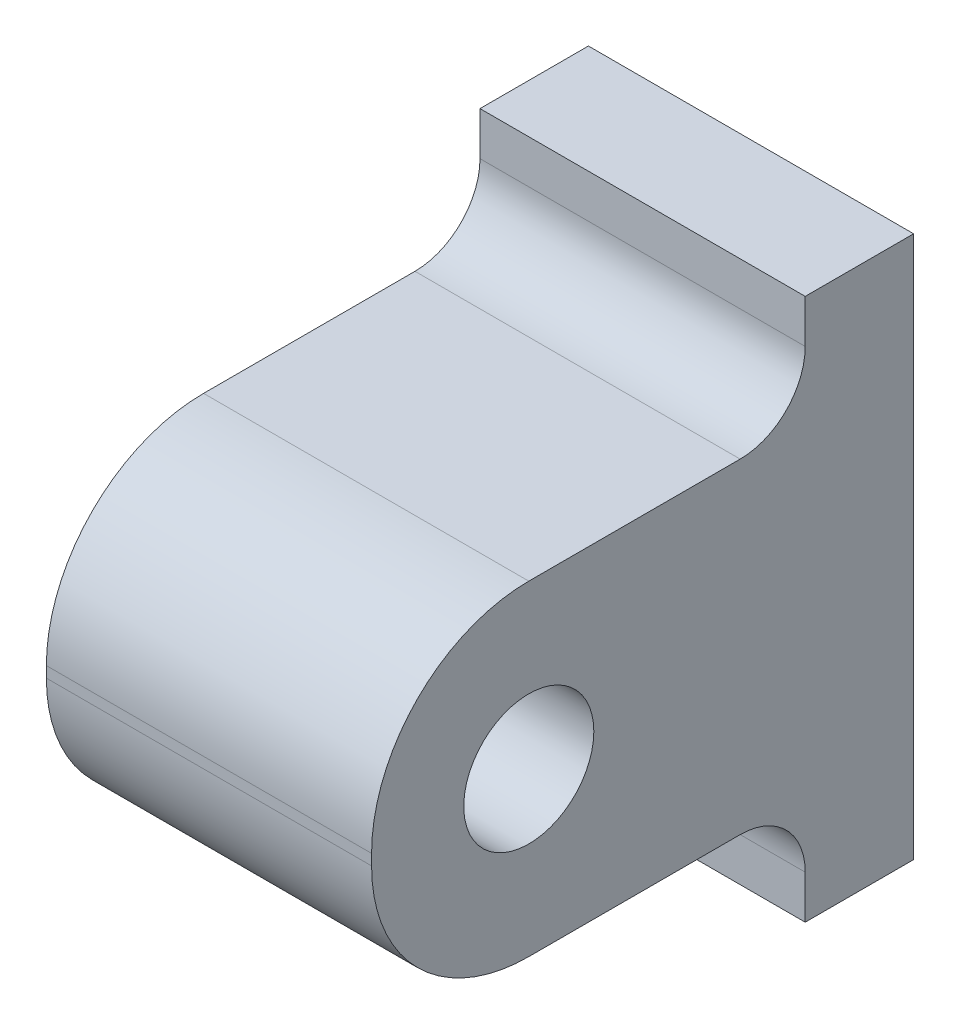
from build123d import *

# Parameters (mm, degrees)
RESSALTO_EXTRUS_O2_DEPTH = 30
ESBO_O5_R                = 6
CORTE_EXTRUS_O1_DEPTH    = 30


with BuildPart() as part:
    # Esboço3 → Ressalto-extrusão2 (new body)
    with BuildSketch(Plane(origin=(0, 0, 0), x_dir=(0, 0, -1), z_dir=(1, 0, 0))):
        with BuildLine():
            Line((42.248831229, -47.335013165), (42.248831229, 2.664986835))
            Line((42.248831229, 2.664986835), (32.248831229, 2.664986835))
            Line((32.248831229, 2.664986835), (32.248831229, -1.335013165))
            ThreePointArc((32.248831229, -1.335013165), (30.491471916, -5.577653852), (26.248831229, -7.335013165))
            Line((26.248831229, -7.335013165), (6.748831229, -7.335013165))
            ThreePointArc((6.748831229, -7.335013165), (-3.504217098, -11.581964838), (-7.751168771, -21.835013165))
            Line((-7.751168771, -21.835013165), (-7.751168771, -22.835013165))
            ThreePointArc((-7.751168771, -22.835013165), (-3.504217098, -33.088061493), (6.748831229, -37.335013165))
            Line((6.748831229, -37.335013165), (26.248831229, -37.335013165))
            ThreePointArc((26.248831229, -37.335013165), (30.491471916, -39.092372478), (32.248831229, -43.335013165))
            Line((32.248831229, -43.335013165), (32.248831229, -47.335013165))
            Line((32.248831229, -47.335013165), (42.248831229, -47.335013165))
        make_face()
    extrude(amount=-RESSALTO_EXTRUS_O2_DEPTH)

    # Esboço5 → Corte-extrusão1 (cut)
    with BuildSketch(Plane(origin=(0, 0, 0), x_dir=(0, 0, -1), z_dir=(1, 0, 0))):
        with Locations((6.748831229, -22.335013165)):
            Circle(ESBO_O5_R)
    extrude(amount=-CORTE_EXTRUS_O1_DEPTH, mode=Mode.SUBTRACT)


solid = part.part
